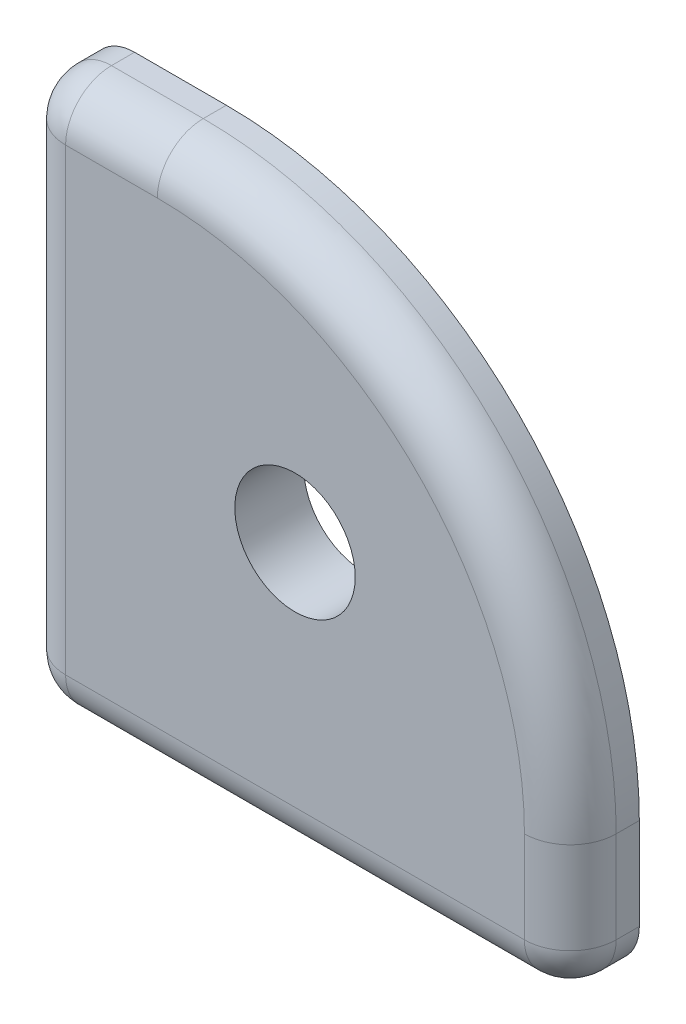
from build123d import *

# Parameters (mm, degrees)
SKETCH1_R      = 4.1656
EXTRUDE1_DEPTH = 4.7752
FILLET1_R      = 3.175
SKETCH2_R      = 1.2065
EXTRUDE2_DEPTH = 2.4892
FILLET2_R      = 1.2065


with BuildPart() as part:
    # Sketch1 → Extrude1 (new body)
    with BuildSketch(Plane.XY):
        with BuildLine():
            Line((39.944028629, 9.505986328), (39.944028629, 15.855986328))
            ThreePointArc((39.944028629, 15.855986328), (31.574604902, 36.0615626), (11.369028629, 44.430986328))
            Line((11.369028629, 44.430986328), (5.019028629, 44.430986328))
            ThreePointArc((5.019028629, 44.430986328), (2.773964599, 43.501050358), (1.844028629, 41.255986328))
            Line((1.844028629, 41.255986328), (1.844028629, 9.505986328))
            ThreePointArc((1.844028629, 9.505986328), (2.773964599, 7.260922298), (5.019028629, 6.330986328))
            Line((5.019028629, 6.330986328), (36.769028629, 6.330986328))
            ThreePointArc((36.769028629, 6.330986328), (39.014092659, 7.260922298), (39.944028629, 9.505986328))
        make_face()
        with Locations((20.894028629, 25.380986328)):
            Circle(SKETCH1_R, mode=Mode.SUBTRACT)
    extrude(amount=EXTRUDE1_DEPTH)

    # Fillet1
    fillet1_edges = [part.edges().sort_by_distance(p)[0] for p in [
        (39.944028629, 12.680986328, 4.7752),
        (31.574604902, 36.0615626, 4.7752),
        (8.194028629, 44.430986328, 4.7752),
        (2.773964599, 43.501050358, 4.7752),
        (1.844028629, 25.380986328, 4.7752),
        (2.773964599, 7.260922298, 4.7752),
        (20.894028629, 6.330986328, 4.7752),
        (39.014092659, 7.260922298, 4.7752),
    ]]
    fillet(fillet1_edges, radius=FILLET1_R)

    # Sketch2 → Extrude2 (add)
    with BuildSketch(Plane(origin=(0, 0, 0), x_dir=(-1, 0, 0), z_dir=(0, 0, -1))):
        with Locations(Location((-29.911028629, 10.648986328, 0), (0, 0, 180))):
            Circle(SKETCH2_R)
        with Locations(Location((-11.877028629, 40.112986328, 0), (0, 0, 180))):
            Circle(SKETCH2_R)
    extrude(amount=EXTRUDE2_DEPTH)

    # Fillet2
    fillet2_edges = [part.edges().sort_by_distance(p)[0] for p in [
        (28.704528629, 10.648986328, -2.4892),
        (10.670528629, 40.112986328, -2.4892),
    ]]
    fillet(fillet2_edges, radius=FILLET2_R)


solid = part.part
